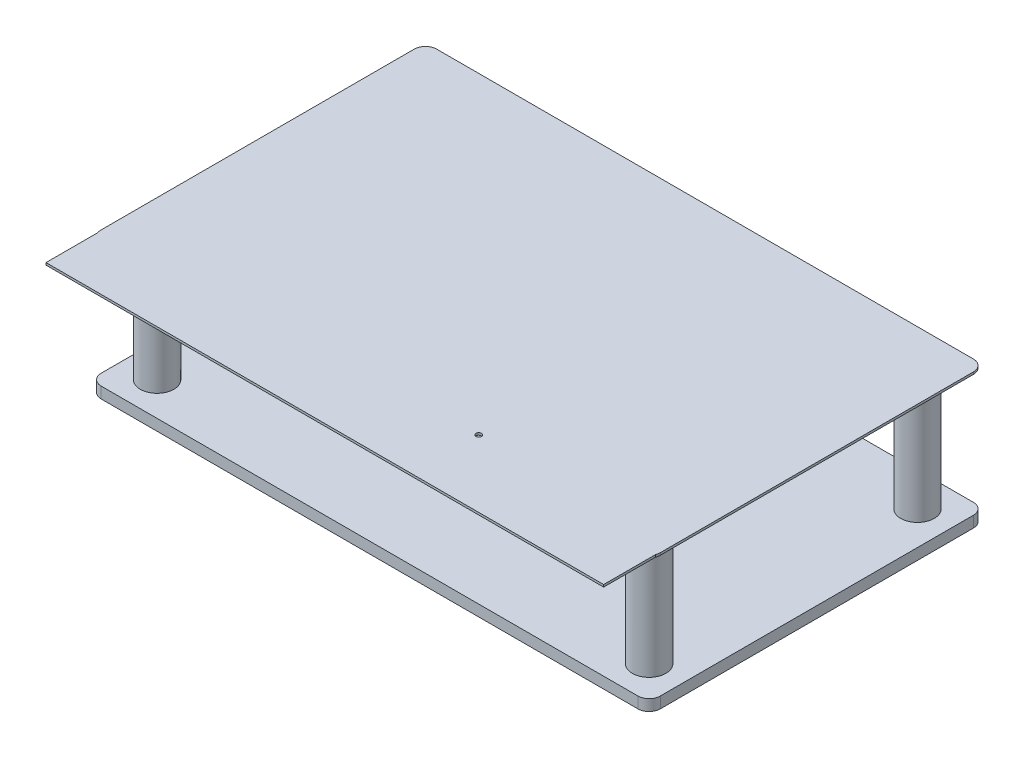
from build123d import *

# Parameters (mm, degrees)
BOSS_EXTRUDE1_DEPTH = 10
SKETCH2_R           = 15
BOSS_EXTRUDE2_DEPTH = 109
BOSS_EXTRUDE3_DEPTH = 2
SKETCH4_W           = 498.700760334
SKETCH4_H           = 80
BOSS_EXTRUDE4_DEPTH = 2
SKETCH5_R           = 2.5
CUT_EXTRUDE1_DEPTH  = 20


with BuildPart() as part:
    # Sketch1 → Boss-Extrude1 (new body)
    with BuildSketch(Plane(origin=(0, 0, 0), x_dir=(1, 0, 0), z_dir=(0, 1, 0))):
        with BuildLine():
            Line((-240, 150), (240, 150))
            ThreePointArc((240, 150), (247.071067812, 147.071067812), (250, 140))
            Line((250, 140), (250, -140))
            ThreePointArc((250, -140), (247.071067812, -147.071067812), (240, -150))
            Line((240, -150), (-240, -150))
            ThreePointArc((-240, -150), (-247.071067812, -147.071067812), (-250, -140))
            Line((-250, -140), (-250, 140))
            ThreePointArc((-250, 140), (-247.071067812, 147.071067812), (-240, 150))
        make_face()
    extrude(amount=BOSS_EXTRUDE1_DEPTH)

    # Sketch2 → Boss-Extrude2 (add)
    with BuildSketch(Plane(origin=(0, 10, 0), x_dir=(1, 0, 0), z_dir=(0, 1, 0))):
        with Locations(Location((-220, 120, 0), (0, 0, 90))):
            Circle(SKETCH2_R)
        with Locations(Location((220, 120, 0), (0, 0, 90))):
            Circle(SKETCH2_R)
        with Locations(Location((220, -120, 0), (0, 0, 90))):
            Circle(SKETCH2_R)
        with Locations(Location((-220, -120, 0), (0, 0, 90))):
            Circle(SKETCH2_R)
    extrude(amount=BOSS_EXTRUDE2_DEPTH)

    # Sketch3 → Boss-Extrude3 (add)
    with BuildSketch(Plane(origin=(0, 119, 0), x_dir=(1, 0, 0), z_dir=(0, 1, 0))):
        with BuildLine():
            Line((-240, 150), (240, 150))
            ThreePointArc((240, 150), (247.071067812, 147.071067812), (250, 140))
            Line((250, 140), (250, -140))
            ThreePointArc((250, -140), (247.071067812, -147.071067812), (240, -150))
            Line((240, -150), (-240, -150))
            ThreePointArc((-240, -150), (-247.071067812, -147.071067812), (-250, -140))
            Line((-250, -140), (-250, 140))
            ThreePointArc((-250, 140), (-247.071067812, 147.071067812), (-240, 150))
        make_face()
    extrude(amount=BOSS_EXTRUDE3_DEPTH)

    # Sketch4 → Boss-Extrude4 (add)
    with BuildSketch(Plane(origin=(0, 121, 0), x_dir=(1, 0, 0), z_dir=(0, 1, 0))):
        with Locations((0, -150)):
            Rectangle(SKETCH4_W, SKETCH4_H)
    extrude(amount=-BOSS_EXTRUDE4_DEPTH)

    # Sketch5 → Cut-Extrude1 (cut)
    with BuildSketch(Plane(origin=(0, 121, 0), x_dir=(1, 0, 0), z_dir=(0, 1, 0))):
        with Locations(Location((77.630380167, -130, 0), (0, 0, 270))):
            Circle(SKETCH5_R)
    extrude(amount=-CUT_EXTRUDE1_DEPTH, mode=Mode.SUBTRACT)


solid = part.part
